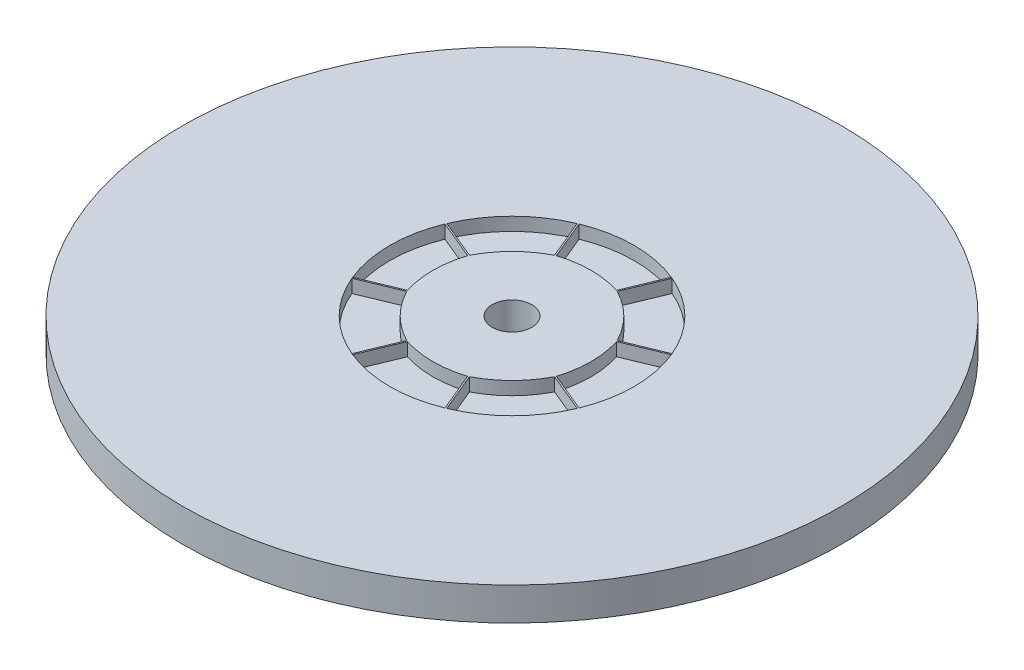
from build123d import *

# Parameters (mm, degrees)
SKETCH1_W          = 470
SKETCH1_H          = 50
CUT_EXTRUDE2_DEPTH = 20


with BuildPart() as part:
    # Sketch1 → Revolve1 (revolve)
    with BuildSketch(Plane(origin=(0, 0, 0), x_dir=(0, 0, -1), z_dir=(1, 0, 0))):
        with Locations((-265, 0)):
            Rectangle(SKETCH1_W, SKETCH1_H)
    revolve(axis=Axis((0, 285.555555556, 0), (0, -1, 0)))

    # Sketch3 → Cut-Extrude2 (cut)
    with BuildSketch(Plane(origin=(0, 25, 0), x_dir=(1, 0, 0), z_dir=(0, 1, 0))):
        with BuildLine():
            Line((-45.632403393, 112.890460705), (-70, 171.719042916))
            ThreePointArc((-70, 171.719042916), (0, 185.438479556), (70, 171.719042916))
            Line((70, 171.719042916), (45.632403393, 112.890460705))
            ThreePointArc((45.632403393, 112.890460705), (0, 120), (-45.632403393, 112.890460705))
        make_face()
        with BuildLine():
            Line((112.092592177, 47.558628415), (170.921174388, 71.926225022))
            ThreePointArc((170.921174388, 71.926225022), (131.124806387, 131.124806387), (71.926225022, 170.921174388))
            Line((71.926225022, 170.921174388), (47.558628415, 112.092592177))
            ThreePointArc((47.558628415, 112.092592177), (84.852813742, 84.852813742), (112.092592177, 47.558628415))
        make_face()
        with BuildLine():
            Line((112.890460705, -45.632403393), (171.719042916, -70))
            ThreePointArc((171.719042916, -70), (185.438479556, 0), (171.719042916, 70))
            Line((171.719042916, 70), (112.890460705, 45.632403393))
            ThreePointArc((112.890460705, 45.632403393), (120, 0), (112.890460705, -45.632403393))
        make_face()
        with BuildLine():
            Line((47.558628415, -112.092592177), (71.926225022, -170.921174388))
            ThreePointArc((71.926225022, -170.921174388), (131.124806387, -131.124806387), (170.921174388, -71.926225022))
            Line((170.921174388, -71.926225022), (112.092592177, -47.558628415))
            ThreePointArc((112.092592177, -47.558628415), (84.852813742, -84.852813742), (47.558628415, -112.092592177))
        make_face()
        with BuildLine():
            Line((-45.632403393, -112.890460705), (-70, -171.719042916))
            ThreePointArc((-70, -171.719042916), (0, -185.438479556), (70, -171.719042916))
            Line((70, -171.719042916), (45.632403393, -112.890460705))
            ThreePointArc((45.632403393, -112.890460705), (0, -120), (-45.632403393, -112.890460705))
        make_face()
        with BuildLine():
            Line((-112.092592177, -47.558628415), (-170.921174388, -71.926225022))
            ThreePointArc((-170.921174388, -71.926225022), (-131.124806387, -131.124806387), (-71.926225022, -170.921174388))
            Line((-71.926225022, -170.921174388), (-47.558628415, -112.092592177))
            ThreePointArc((-47.558628415, -112.092592177), (-84.852813742, -84.852813742), (-112.092592177, -47.558628415))
        make_face()
        with BuildLine():
            Line((-112.890460705, 45.632403393), (-171.719042916, 70))
            ThreePointArc((-171.719042916, 70), (-185.438479556, 0), (-171.719042916, -70))
            Line((-171.719042916, -70), (-112.890460705, -45.632403393))
            ThreePointArc((-112.890460705, -45.632403393), (-120, 0), (-112.890460705, 45.632403393))
        make_face()
        with BuildLine():
            Line((-47.558628415, 112.092592177), (-71.926225022, 170.921174388))
            ThreePointArc((-71.926225022, 170.921174388), (-131.124806387, 131.124806387), (-170.921174388, 71.926225022))
            Line((-170.921174388, 71.926225022), (-112.092592177, 47.558628415))
            ThreePointArc((-112.092592177, 47.558628415), (-84.852813742, 84.852813742), (-47.558628415, 112.092592177))
        make_face()
    extrude(amount=-CUT_EXTRUDE2_DEPTH, mode=Mode.SUBTRACT)


solid = part.part
